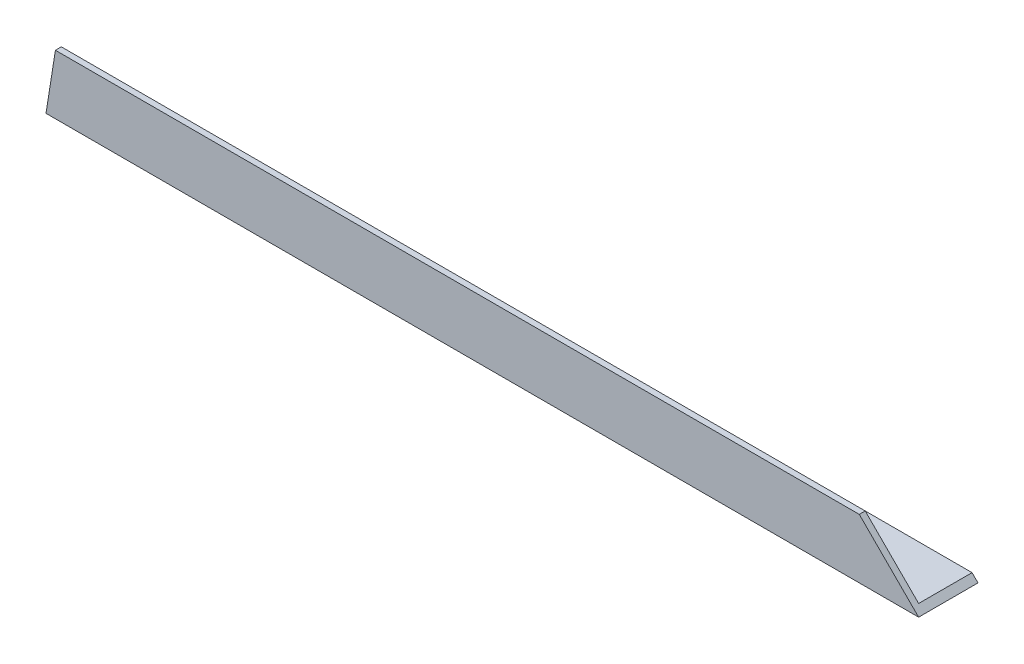
from build123d import *

# Parameters (mm, degrees)
BOSS_EXTRUDE1_DEPTH = 294
CUT_EXTRUDE1_DEPTH  = 296.357410606


with BuildPart() as part:
    # Sketch1 → Boss-Extrude1 (new body)
    with BuildSketch(Plane(origin=(0, 0, 0), x_dir=(0, 0, -1), z_dir=(1, 0, 0))):
        Polygon((0, 20), (0, 0), (20, 0), (20, 2), (2, 2), (2, 20), align=None)
    extrude(amount=BOSS_EXTRUDE1_DEPTH)

    # Sketch2 → Cut-Extrude1 (cut, through all)
    with BuildSketch(Plane(origin=(0, 0, 0), x_dir=(-1, 0, 0), z_dir=(0, 0, -1))):
        Polygon((0, 0), (-3.167688806, 20), (0, 20), align=None)
        Polygon((-294, 0), (-274, 20), (-294, 20), align=None)
    extrude(amount=CUT_EXTRUDE1_DEPTH, mode=Mode.SUBTRACT)


solid = part.part
